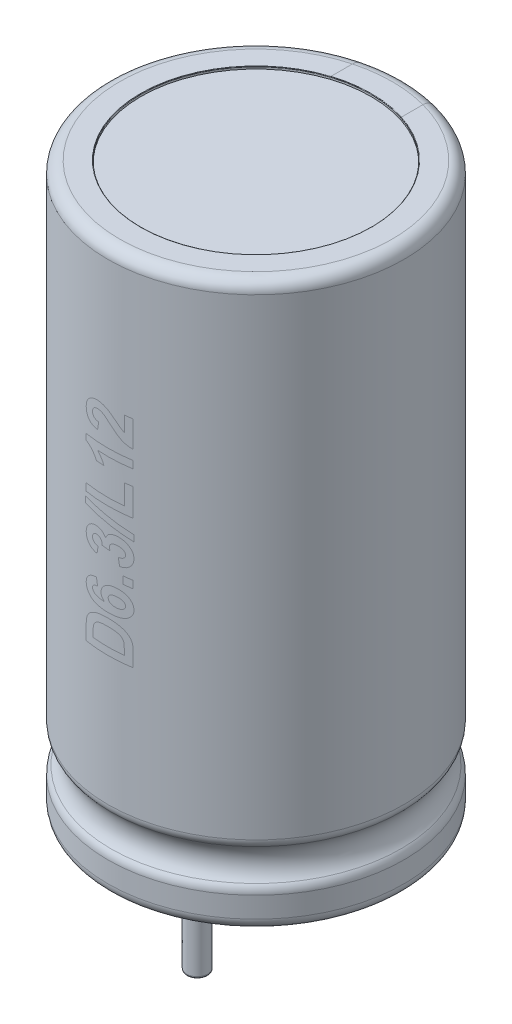
from build123d import *

# Parameters (mm, degrees)
SKETCH1_R           = 3.15
BOSS_EXTRUDE1_DEPTH = 12
FILLET1_R           = 0.25
SKETCH2_R           = 2.45
CUT_EXTRUDE1_DEPTH  = 0.05
SKETCH3_R           = 0.5
FILLET2_R           = 0.25
CUT_EXTRUDE2_START  = -0.1
SKETCH4_R           = 2.45
CUT_EXTRUDE2_DEPTH  = 0.1
FILLET3_R           = 0.01
SKETCH8_R           = 0.35
CUT_EXTRUDE3_DEPTH  = 0.1
SKETCH9_R           = 0.225
BOSS_EXTRUDE2_DEPTH = 2.5
FILLET4_R           = 0.05


with BuildPart() as part:
    # Sketch1 → Boss-Extrude1 (new body)
    with BuildSketch(Plane(origin=(0, 0, 0), x_dir=(1, 0, 0), z_dir=(0, 1, 0))):
        Circle(SKETCH1_R)
    extrude(amount=BOSS_EXTRUDE1_DEPTH)

    # Fillet1
    fillet1_edges = [part.edges().sort_by_distance(p)[0] for p in [
        (-3.15, 12, 0),
        (-3.15, 0, 0),
    ]]
    fillet(fillet1_edges, radius=FILLET1_R)

    # Sketch2 → Cut-Extrude1 (cut)
    with BuildSketch(Plane(origin=(0, 12, 0), x_dir=(1, 0, 0), z_dir=(0, 1, 0))):
        Circle(SKETCH2_R)
    extrude(amount=-CUT_EXTRUDE1_DEPTH, mode=Mode.SUBTRACT)

    # Sketch3 → Cut-Revolve1 (revolve, cut)
    with BuildSketch(Plane.XY):
        with Locations((3.45, 1.2)):
            Circle(SKETCH3_R)
    revolve(axis=Axis((0, 0, 0), (0, 1, 0)), mode=Mode.SUBTRACT)

    # Fillet2
    fillet2_edges = [part.edges().sort_by_distance(p)[0] for p in [
        (-3.15, 1.6, 0),
        (-3.15, 0.8, 0),
    ]]
    fillet(fillet2_edges, radius=FILLET2_R)

    # Sketch4 → Cut-Extrude2 (cut)
    with BuildSketch(Plane.XZ.offset(CUT_EXTRUDE2_START)):
        Circle(SKETCH4_R)
    extrude(amount=CUT_EXTRUDE2_DEPTH, mode=Mode.SUBTRACT)

    # Fillet3
    fillet3_edges = [part.edges().sort_by_distance(p)[0] for p in [
        (-2.45, 12, 0),
    ]]
    fillet(fillet3_edges, radius=FILLET3_R)

    # Sketch8 → Cut-Extrude3 (cut)
    with BuildSketch(Plane.XZ.offset(-0.1)):
        with Locations((0, 1.25)):
            Circle(SKETCH8_R)
        with Locations((0, -1.25)):
            Circle(SKETCH8_R)
    extrude(amount=-CUT_EXTRUDE3_DEPTH, mode=Mode.SUBTRACT)

    # Sketch9 → Boss-Extrude2 (add)
    with BuildSketch(Plane.XZ.offset(-0.2)):
        with Locations((0, 1.25)):
            Circle(SKETCH9_R)
        with Locations((0, -1.25)):
            Circle(SKETCH9_R)
    extrude(amount=BOSS_EXTRUDE2_DEPTH)

    # Fillet4
    fillet4_edges = [part.edges().sort_by_distance(p)[0] for p in [
        (-0.225, -2.3, 1.25),
        (-0.225, -2.3, -1.25),
    ]]
    fillet(fillet4_edges, radius=FILLET4_R)


solid = part.part
